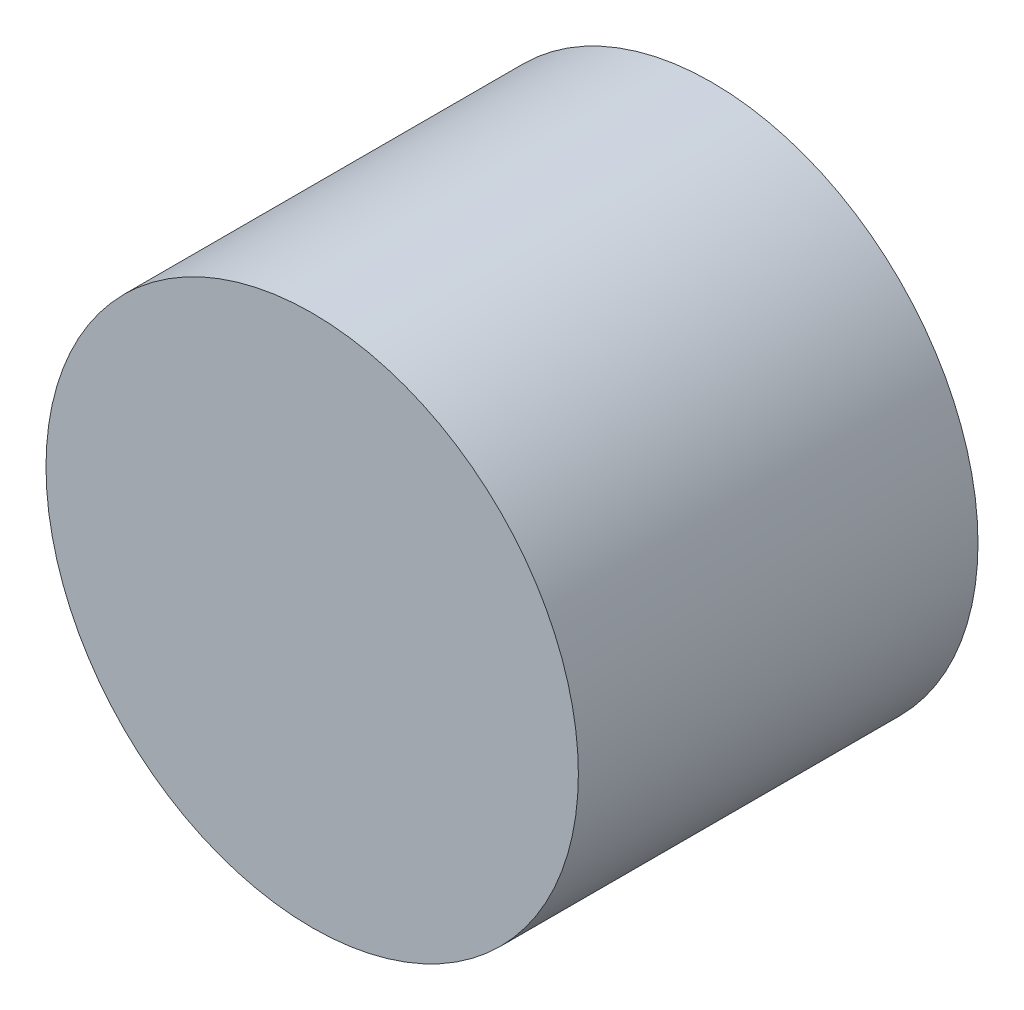
from build123d import *

# Parameters (mm, degrees)
SKETCH1_R           = 9.24319
BOSS_EXTRUDE1_DEPTH = 13.87722


with BuildPart() as part:
    # Sketch1 → Boss-Extrude1 (new body)
    with BuildSketch(Plane.XY):
        with Locations((-4.913, 6.281)):
            Circle(SKETCH1_R)
    extrude(amount=BOSS_EXTRUDE1_DEPTH)


solid = part.part
